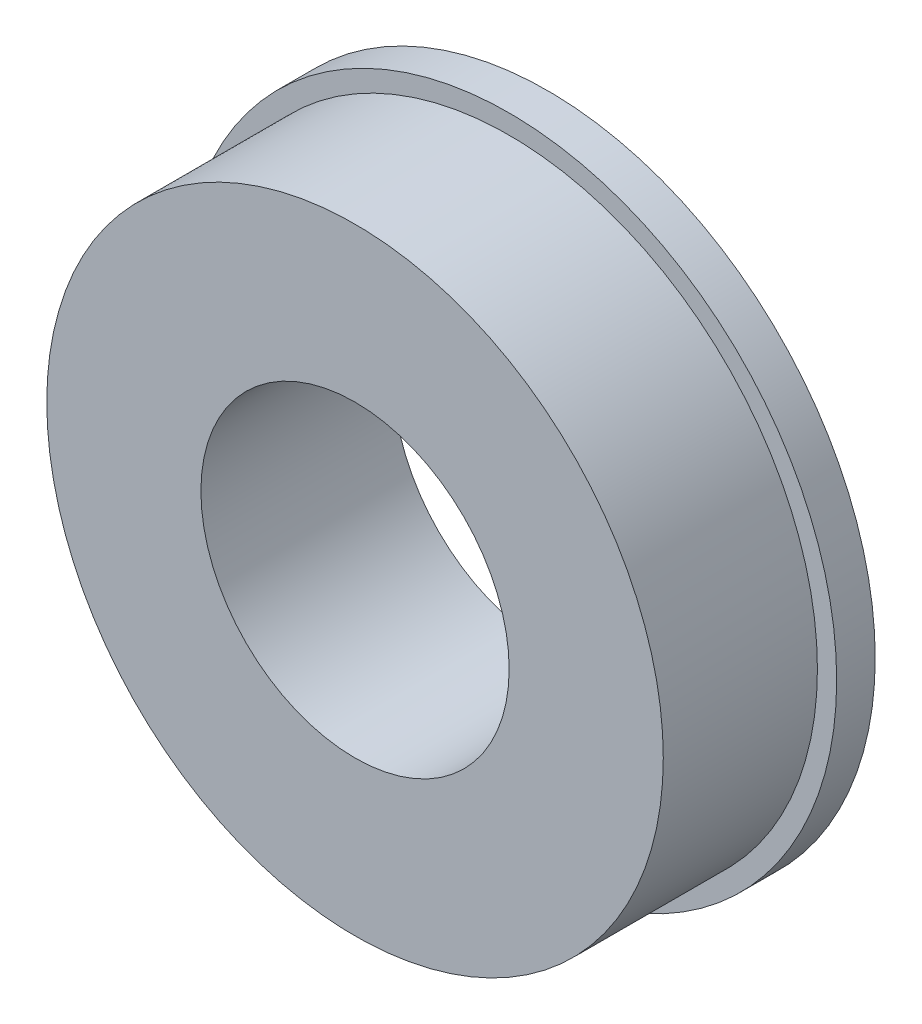
from build123d import *

# Parameters (mm, degrees)
SKETCH_1_R          = 8.5
EXTRUDE_1_DEPTH     = 1
SKETCH_2_R          = 8
EXTRUDE_2_DEPTH     = 4
SKETCH_3_R          = 4
CUT_EXTRUDE_1_DEPTH = 5


with BuildPart() as part:
    # 草图1 → 凸台-拉伸1 (new body)
    with BuildSketch(Plane.XY):
        Circle(SKETCH_1_R)
    extrude(amount=EXTRUDE_1_DEPTH)

    # 草图2 → 凸台-拉伸2 (add)
    with BuildSketch(Plane.XY.offset(1)):
        Circle(SKETCH_2_R)
    extrude(amount=EXTRUDE_2_DEPTH)

    # 草图3 → 切除-拉伸1 (cut)
    with BuildSketch(Plane.XY.offset(5)):
        Circle(SKETCH_3_R)
    extrude(amount=-CUT_EXTRUDE_1_DEPTH, mode=Mode.SUBTRACT)


solid = part.part
